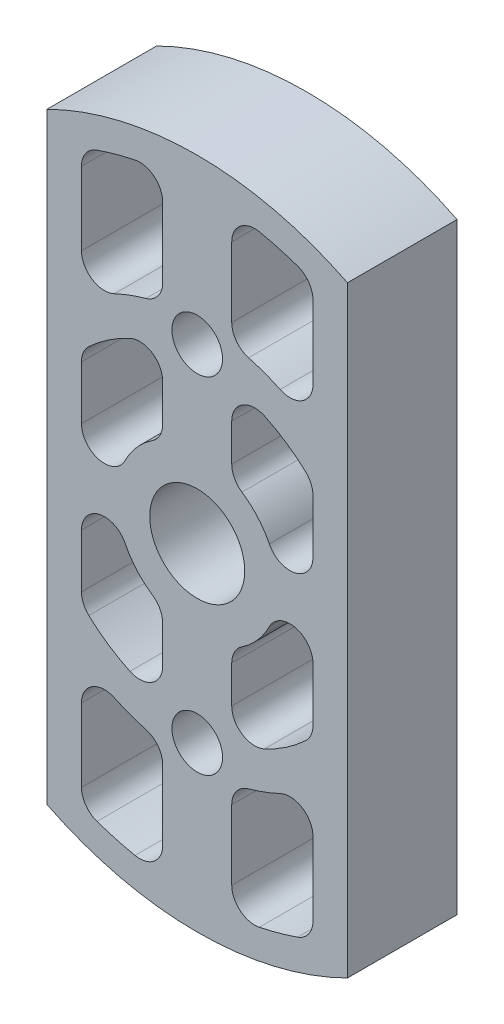
from build123d import *

# Parameters (mm, degrees)
SKETCH1_R            = 29.25
EXTRUDE_3_8_DEPTH    = 9.525
CUT_EXTRUDE1_DEPTH   = 9.525
SKETCH3_R            = 2.2
M4_THROUGH_DEPTH     = 9.525
SKETCH4_R            = 4.1275
F_3_8_16_DRILL_DEPTH = 9.525
SKETCH6_W            = 18.02935576
SKETCH6_H            = 57.579918791
CUT_EXTRUDE2_DEPTH   = 9.525


with BuildPart() as part:
    # Sketch1 → 3/8 (new body)
    with BuildSketch(Plane.XY):
        with Locations(Location((0, 0, 0), (0, 0, 180))):
            Circle(SKETCH1_R)
    extrude(amount=EXTRUDE_3_8_DEPTH)

    # Sketch2 → Cut-Extrude1 (cut)
    with BuildSketch(Plane.XY.offset(9.525)):
        with BuildLine():
            Line((-3, 24.219267124), (-3, 18.154700472))
            ThreePointArc((-3, 18.154700472), (-3.409072822, 16.942697702), (-4.468950714, 16.226492325))
            ThreePointArc((-4.468950714, 16.226492325), (-5.859541661, 15.777716729), (-7.205966503, 15.210017108))
            ThreePointArc((-7.205966503, 15.210017108), (-9.131700947, 15.327380042), (-10.062257748, 17.017436623))
            Line((-10.062257748, 17.017436623), (-10.062257748, 23.378898605))
            ThreePointArc((-10.062257748, 23.378898605), (-9.690760884, 24.539922954), (-8.714280211, 25.269630397))
            ThreePointArc((-8.714280211, 25.269630397), (-7.073918129, 25.776977757), (-5.404367165, 26.177962402))
            ThreePointArc((-5.404367165, 26.177962402), (-3.736816389, 25.769869318), (-3, 24.219267124))
        make_face()
        with BuildLine():
            Line((-3, 10.72213294), (-3, 7.483314774))
            ThreePointArc((-3, 7.483314774), (-3.236165793, 6.540505732), (-3.888888889, 5.820355935))
            ThreePointArc((-3.888888889, 5.820355935), (-5.257283867, 4.621792546), (-6.270644915, 3.111111111))
            ThreePointArc((-6.270644915, 3.111111111), (-8.518752181, 2.052793582), (-10.062257748, 4))
            Line((-10.062257748, 4), (-10.062257748, 8.658183111))
            ThreePointArc((-10.062257748, 8.658183111), (-9.896091132, 9.45634044), (-9.425202627, 10.121870666))
            ThreePointArc((-9.425202627, 10.121870666), (-7.729958395, 11.468847089), (-5.845262531, 12.534736386))
            ThreePointArc((-5.845262531, 12.534736386), (-3.925412885, 12.408923541), (-3, 10.72213294))
        make_face()
        with BuildLine():
            Line((3, 10.72213294), (3, 7.483314774))
            ThreePointArc((3, 7.483314774), (3.236165793, 6.540505732), (3.888888889, 5.820355935))
            ThreePointArc((3.888888889, 5.820355935), (5.257283867, 4.621792546), (6.270644915, 3.111111111))
            ThreePointArc((6.270644915, 3.111111111), (8.518752181, 2.052793582), (10.062257748, 4))
            Line((10.062257748, 4), (10.062257748, 8.658183111))
            ThreePointArc((10.062257748, 8.658183111), (9.896091132, 9.45634044), (9.425202627, 10.121870666))
            ThreePointArc((9.425202627, 10.121870666), (7.729958395, 11.468847089), (5.845262531, 12.534736386))
            ThreePointArc((5.845262531, 12.534736386), (3.925412885, 12.408923541), (3, 10.72213294))
        make_face()
        with BuildLine():
            Line((3, 24.219267124), (3, 18.154700472))
            ThreePointArc((3, 18.154700472), (3.409072822, 16.942697702), (4.468950714, 16.226492325))
            ThreePointArc((4.468950714, 16.226492325), (5.859541661, 15.777716729), (7.205966503, 15.210017108))
            ThreePointArc((7.205966503, 15.210017108), (9.131700947, 15.327380042), (10.062257748, 17.017436623))
            Line((10.062257748, 17.017436623), (10.062257748, 23.378898605))
            ThreePointArc((10.062257748, 23.378898605), (9.690760884, 24.539922954), (8.714280211, 25.269630397))
            ThreePointArc((8.714280211, 25.269630397), (7.073918129, 25.776977757), (5.404367165, 26.177962402))
            ThreePointArc((5.404367165, 26.177962402), (3.736816389, 25.769869318), (3, 24.219267124))
        make_face()
        with BuildLine():
            Line((-3, -10.72213294), (-3, -7.483314774))
            ThreePointArc((-3, -7.483314774), (-3.236165793, -6.540505732), (-3.888888889, -5.820355935))
            ThreePointArc((-3.888888889, -5.820355935), (-5.257283867, -4.621792546), (-6.270644915, -3.111111111))
            ThreePointArc((-6.270644915, -3.111111111), (-8.518752181, -2.052793582), (-10.062257748, -4))
            Line((-10.062257748, -4), (-10.062257748, -8.658183111))
            ThreePointArc((-10.062257748, -8.658183111), (-9.896091132, -9.45634044), (-9.425202627, -10.121870666))
            ThreePointArc((-9.425202627, -10.121870666), (-7.729958395, -11.468847089), (-5.845262531, -12.534736386))
            ThreePointArc((-5.845262531, -12.534736386), (-3.925412885, -12.408923541), (-3, -10.72213294))
        make_face()
        with BuildLine():
            Line((3, -10.72213294), (3, -7.483314774))
            ThreePointArc((3, -7.483314774), (3.236165793, -6.540505732), (3.888888889, -5.820355935))
            ThreePointArc((3.888888889, -5.820355935), (5.257283867, -4.621792546), (6.270644915, -3.111111111))
            ThreePointArc((6.270644915, -3.111111111), (8.518752181, -2.052793582), (10.062257748, -4))
            Line((10.062257748, -4), (10.062257748, -8.658183111))
            ThreePointArc((10.062257748, -8.658183111), (9.896091132, -9.45634044), (9.425202627, -10.121870666))
            ThreePointArc((9.425202627, -10.121870666), (7.729958395, -11.468847089), (5.845262531, -12.534736386))
            ThreePointArc((5.845262531, -12.534736386), (3.925412885, -12.408923541), (3, -10.72213294))
        make_face()
        with BuildLine():
            Line((3, -24.219267124), (3, -18.154700472))
            ThreePointArc((3, -18.154700472), (3.409072822, -16.942697702), (4.468950714, -16.226492325))
            ThreePointArc((4.468950714, -16.226492325), (5.859541661, -15.777716729), (7.205966503, -15.210017108))
            ThreePointArc((7.205966503, -15.210017108), (9.131700947, -15.327380042), (10.062257748, -17.017436623))
            Line((10.062257748, -17.017436623), (10.062257748, -23.378898605))
            ThreePointArc((10.062257748, -23.378898605), (9.690760884, -24.539922954), (8.714280211, -25.269630397))
            ThreePointArc((8.714280211, -25.269630397), (7.073918129, -25.776977757), (5.404367165, -26.177962402))
            ThreePointArc((5.404367165, -26.177962402), (3.736816389, -25.769869318), (3, -24.219267124))
        make_face()
        with BuildLine():
            Line((-3, -24.219267124), (-3, -18.154700472))
            ThreePointArc((-3, -18.154700472), (-3.409072822, -16.942697702), (-4.468950714, -16.226492325))
            ThreePointArc((-4.468950714, -16.226492325), (-5.859541661, -15.777716729), (-7.205966503, -15.210017108))
            ThreePointArc((-7.205966503, -15.210017108), (-9.131700947, -15.327380042), (-10.062257748, -17.017436623))
            Line((-10.062257748, -17.017436623), (-10.062257748, -23.378898605))
            ThreePointArc((-10.062257748, -23.378898605), (-9.690760884, -24.539922954), (-8.714280211, -25.269630397))
            ThreePointArc((-8.714280211, -25.269630397), (-7.073918129, -25.776977757), (-5.404367165, -26.177962402))
            ThreePointArc((-5.404367165, -26.177962402), (-3.736816389, -25.769869318), (-3, -24.219267124))
        make_face()
    extrude(amount=-CUT_EXTRUDE1_DEPTH, mode=Mode.SUBTRACT)

    # Sketch3 → M4_through (cut)
    with BuildSketch(Plane.XY.offset(9.525)):
        with Locations((0, 15)):
            Circle(SKETCH3_R)
        with Locations((0, -15)):
            Circle(SKETCH3_R)
    extrude(amount=-M4_THROUGH_DEPTH, mode=Mode.SUBTRACT)

    # Sketch4 → 3/8_-16-DRILL (cut)
    with BuildSketch(Plane.XY.offset(9.525)):
        Circle(SKETCH4_R)
    extrude(amount=-F_3_8_16_DRILL_DEPTH, mode=Mode.SUBTRACT)

    # Sketch6 → Cut-Extrude2 (cut)
    with BuildSketch(Plane.XY.offset(9.525)):
        with Locations((-22.076935628, -1.336167669)):
            Rectangle(SKETCH6_W, SKETCH6_H)
        with Locations((22.076935628, -1.336167669)):
            Rectangle(SKETCH6_W, SKETCH6_H)
    extrude(amount=-CUT_EXTRUDE2_DEPTH, mode=Mode.SUBTRACT)


solid = part.part
